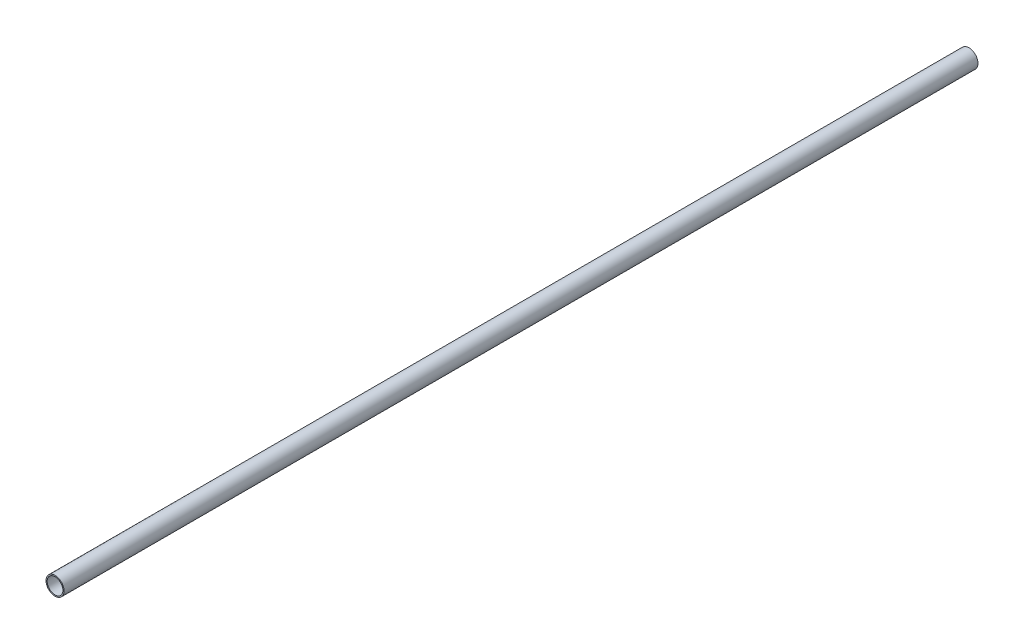
from build123d import *

# Parameters (mm, degrees)
SKETCH1_R           = 30.1625
SKETCH1_R_2         = 26.2509
BOSS_EXTRUDE1_DEPTH = 3048


with BuildPart() as part:
    # Sketch1 → Boss-Extrude1 (new body)
    with BuildSketch(Plane.XY):
        Circle(SKETCH1_R)
        Circle(SKETCH1_R_2, mode=Mode.SUBTRACT)
    extrude(amount=BOSS_EXTRUDE1_DEPTH)


solid = part.part
